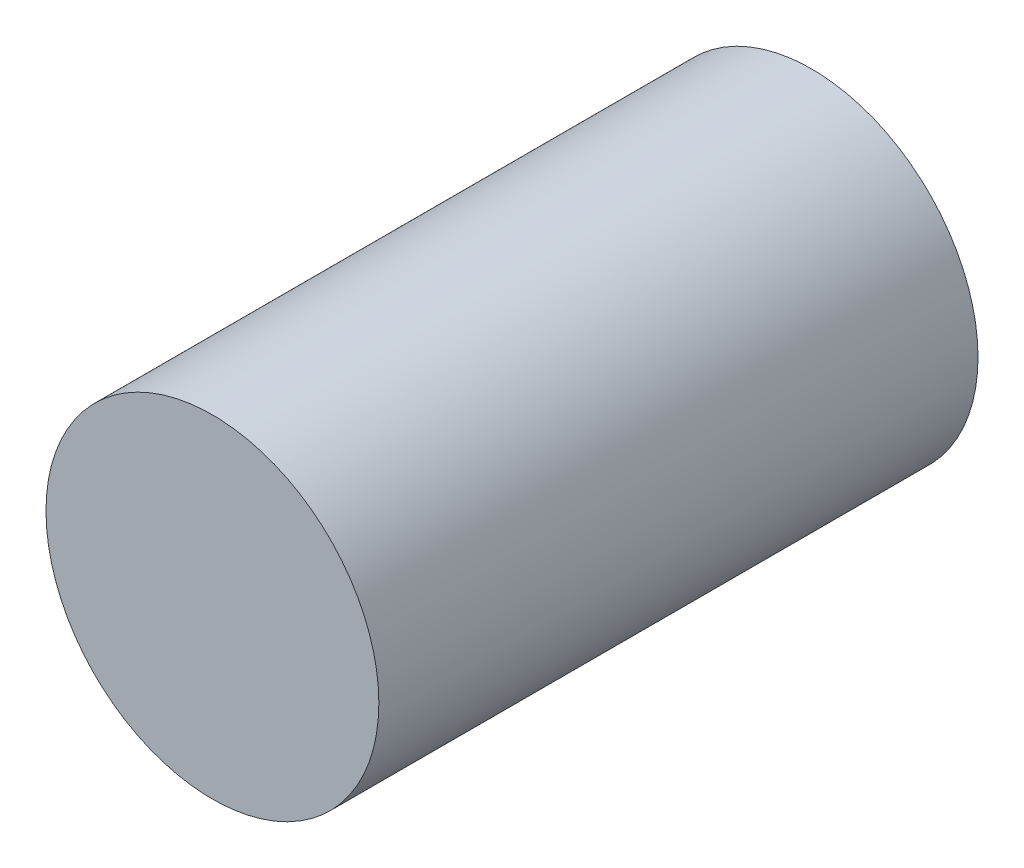
from build123d import *

# Parameters (mm, degrees)
SKETCH1_R           = 63.5
BOSS_EXTRUDE1_DEPTH = 114.3


with BuildPart() as part:
    # Sketch1 → Boss-Extrude1 (new, symmetric)
    with BuildSketch(Plane.XY):
        Circle(SKETCH1_R)
    extrude(amount=BOSS_EXTRUDE1_DEPTH, both=True)


solid = part.part
